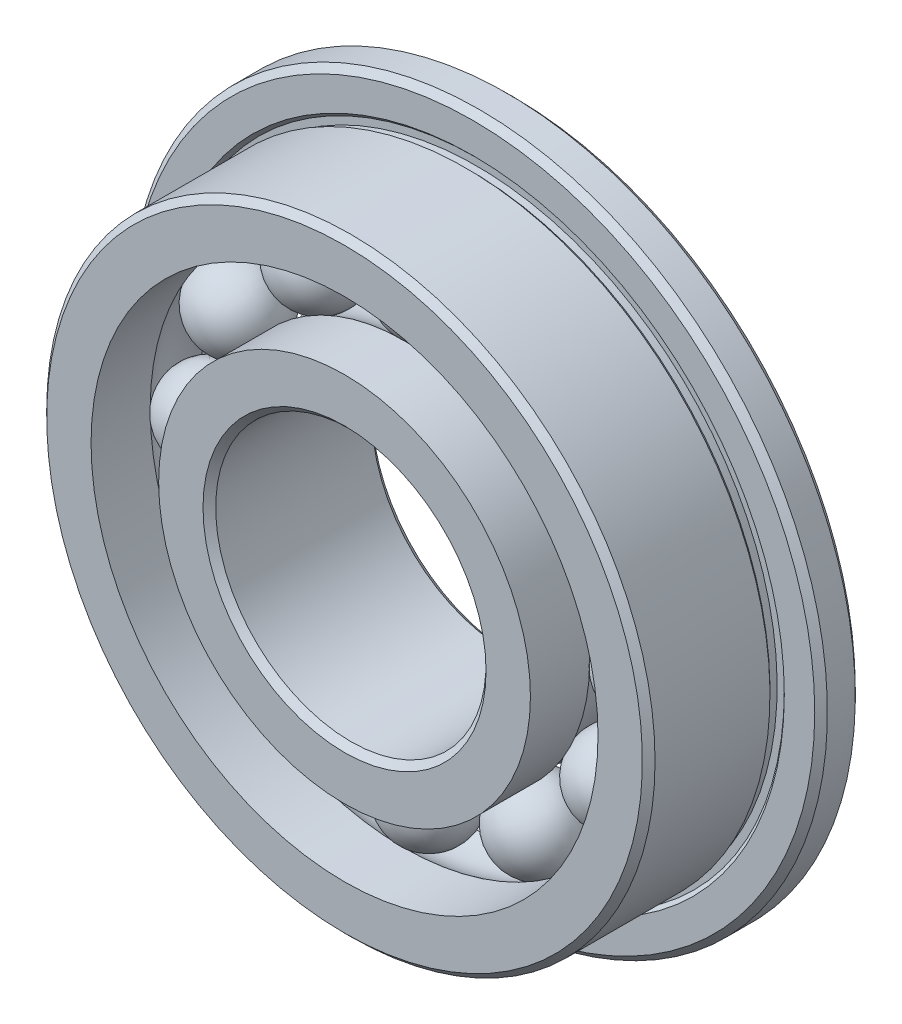
from build123d import *

# Parameters (mm, degrees)
FILLET1_SIZE      = 0.09375
FILLET2_SIZE      = 0.09375
CIRPATTERN3_COUNT = 12


with BuildPart() as part:
    # Sketch2 → Revolve1 (revolve)
    with BuildSketch(Plane(origin=(0, 0, 0), x_dir=(0, 0, -1), z_dir=(1, 0, 0)), mode=Mode.PRIVATE) as revolve1_sk:
        with BuildLine():
            Line((1.25, 5.15), (0.65, 5.15))
            Line((0.65, 5.15), (0.65, 4.606066017))
            Line((0.65, 4.606066017), (0.703033009, 4.553033009))
            Line((0.703033009, 4.553033009), (0.703033009, 4.446966991))
            Line((0.703033009, 4.446966991), (0.596966991, 4.446966991))
            Line((0.596966991, 4.446966991), (0.543933983, 4.5))
            Line((0.543933983, 4.5), (-1.25, 4.5))
            Line((-1.25, 4.5), (-1.25, 3.75))
            Line((-1.25, 3.75), (-0.375, 3.75))
            ThreePointArc((-0.375, 3.75), (0, 3.875), (0.375, 3.75))
            Line((0.375, 3.75), (1.25, 3.75))
            Line((1.25, 3.75), (1.25, 5.15))
        make_face()
        with BuildLine():
            Line((1.25, 2), (-1.25, 2))
            Line((-1.25, 2), (-1.25, 2.75))
            Line((-1.25, 2.75), (-0.375, 2.75))
            ThreePointArc((-0.375, 2.75), (0, 2.625), (0.375, 2.75))
            Line((0.375, 2.75), (1.25, 2.75))
            Line((1.25, 2.75), (1.25, 2))
        make_face()
    revolve(revolve1_sk.sketch.rotate(Axis((0, 0, 0), (0, 0, -1)), 180), axis=Axis((0, 0, 0), (0, 0, -1)))

    # Fillet1
    fillet1_edges = [part.edges().sort_by_distance(p)[0] for p in [
        (0, 4.5, 1.25),
        (0, 5.15, -1.25),
        (0, 5.15, -0.65),
    ]]
    chamfer(fillet1_edges, length=FILLET1_SIZE)

    # Fillet2
    fillet2_edges = [part.edges().sort_by_distance(p)[0] for p in [
        (0, 2, -1.25),
        (0, 2, 1.25),
    ]]
    chamfer(fillet2_edges, length=FILLET2_SIZE)


with BuildPart() as body_2:
    # Sketch7 → Revolve3 (revolve)
    with BuildSketch(Plane.XY):
        with BuildLine():
            Line((0, 3.875), (0, 2.625))
            ThreePointArc((0, 2.625), (-0.625, 3.25), (0, 3.875))
        make_face()
    revolve(axis=Axis((0, 3.875, 0), (0, -1, 0)))


with BuildPart() as cirpattern3_1:
    # CirPattern3: pattern copy
    add(body_2.part.rotate(Axis((0, 0, 0), (0, 0, 1)), 1 * 360 / CIRPATTERN3_COUNT))


with BuildPart() as cirpattern3_2:
    # CirPattern3: pattern copy
    add(body_2.part.rotate(Axis((0, 0, 0), (0, 0, 1)), 2 * 360 / CIRPATTERN3_COUNT))


with BuildPart() as cirpattern3_3:
    # CirPattern3: pattern copy
    add(body_2.part.rotate(Axis((0, 0, 0), (0, 0, 1)), 3 * 360 / CIRPATTERN3_COUNT))


with BuildPart() as cirpattern3_4:
    # CirPattern3: pattern copy
    add(body_2.part.rotate(Axis((0, 0, 0), (0, 0, 1)), 4 * 360 / CIRPATTERN3_COUNT))


with BuildPart() as cirpattern3_5:
    # CirPattern3: pattern copy
    add(body_2.part.rotate(Axis((0, 0, 0), (0, 0, 1)), 5 * 360 / CIRPATTERN3_COUNT))


with BuildPart() as cirpattern3_6:
    # CirPattern3: pattern copy
    add(body_2.part.rotate(Axis((0, 0, 0), (0, 0, 1)), 6 * 360 / CIRPATTERN3_COUNT))


with BuildPart() as cirpattern3_7:
    # CirPattern3: pattern copy
    add(body_2.part.rotate(Axis((0, 0, 0), (0, 0, 1)), 7 * 360 / CIRPATTERN3_COUNT))


with BuildPart() as cirpattern3_8:
    # CirPattern3: pattern copy
    add(body_2.part.rotate(Axis((0, 0, 0), (0, 0, 1)), 8 * 360 / CIRPATTERN3_COUNT))


with BuildPart() as cirpattern3_9:
    # CirPattern3: pattern copy
    add(body_2.part.rotate(Axis((0, 0, 0), (0, 0, 1)), 9 * 360 / CIRPATTERN3_COUNT))


with BuildPart() as cirpattern3_10:
    # CirPattern3: pattern copy
    add(body_2.part.rotate(Axis((0, 0, 0), (0, 0, 1)), 10 * 360 / CIRPATTERN3_COUNT))


with BuildPart() as cirpattern3_11:
    # CirPattern3: pattern copy
    add(body_2.part.rotate(Axis((0, 0, 0), (0, 0, 1)), 11 * 360 / CIRPATTERN3_COUNT))


solid = Compound([part.part, body_2.part, cirpattern3_1.part, cirpattern3_2.part, cirpattern3_3.part, cirpattern3_4.part, cirpattern3_5.part, cirpattern3_6.part, cirpattern3_7.part, cirpattern3_8.part, cirpattern3_9.part, cirpattern3_10.part, cirpattern3_11.part])
